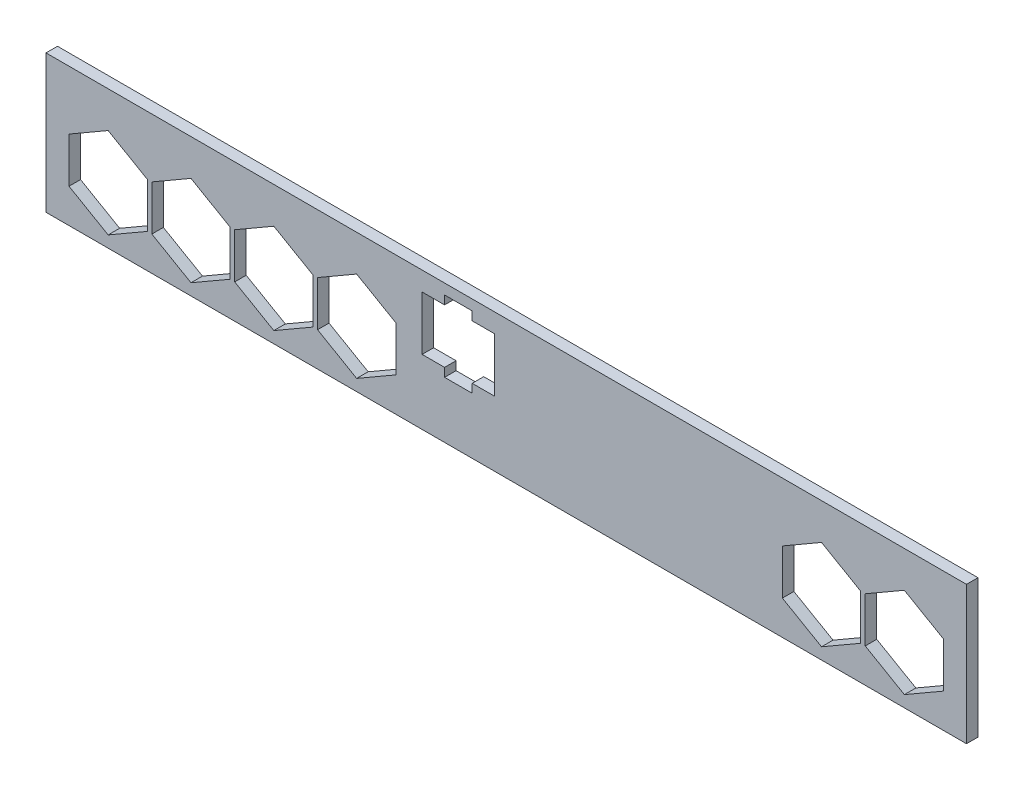
from build123d import *

# Parameters (mm, degrees)
SKETCH1_W           = 254
SKETCH1_H           = 38.1
BOSS_EXTRUDE1_DEPTH = 3.175
CUT_EXTRUDE1_DEPTH  = 10.414
CUT_EXTRUDE2_DEPTH  = 3.175


with BuildPart() as part:
    # Sketch1 → Boss-Extrude1 (new body)
    with BuildSketch(Plane.XY):
        Rectangle(SKETCH1_W, SKETCH1_H)
    extrude(amount=BOSS_EXTRUDE1_DEPTH)

    # Sketch4 → Cut-Extrude1 (cut)
    with BuildSketch(Plane.XY.offset(3.175)):
        Polygon((-99.060120052, -9.6425385), (-99.060120052, 2.8223845), (-109.855060026, 9.054846), (-120.65, 2.8223845), (-120.65, -9.6425385), (-109.855060026, -15.875), align=None)
        Polygon((-76.200120052, -9.6425385), (-76.200120052, 2.8223845), (-86.995060026, 9.054846), (-97.79, 2.8223845), (-97.79, -9.6425385), (-86.995060026, -15.875), align=None)
        Polygon((-53.340120052, -9.6425385), (-53.340120052, 2.8223845), (-64.135060026, 9.054846), (-74.93, 2.8223845), (-74.93, -9.6425385), (-64.135060026, -15.875), align=None)
        Polygon((-30.480120052, -9.6425385), (-30.480120052, 2.8223845), (-41.275060026, 9.054846), (-52.07, 2.8223845), (-52.07, -9.6425385), (-41.275060026, -15.875), align=None)
        Polygon((120.65, -9.6425385), (120.65, 2.8223845), (109.855060026, 9.054846), (99.060120052, 2.8223845), (99.060120052, -9.6425385), (109.855060026, -15.875), align=None)
        Polygon((97.79, -9.6425385), (97.79, 2.8223845), (86.995060026, 9.054846), (76.200120052, 2.8223845), (76.200120052, -9.6425385), (86.995060026, -15.875), align=None)
    extrude(amount=-CUT_EXTRUDE1_DEPTH, mode=Mode.SUBTRACT)

    # Sketch2 → Cut-Extrude2 (cut)
    with BuildSketch(Plane.XY.offset(3.175)):
        Polygon((-3.20675, -1.11125), (-3.20675, 13.81125), (-9.398, 13.81125), (-9.398, 16.1925), (-17.018, 16.1925), (-17.018, 13.81125), (-23.20925, 13.81125), (-23.20925, -1.11125), (-17.018, -1.11125), (-17.018, -3.4925), (-9.398, -3.4925), (-9.398, -1.11125), align=None)
    extrude(amount=-CUT_EXTRUDE2_DEPTH, mode=Mode.SUBTRACT)


solid = part.part
